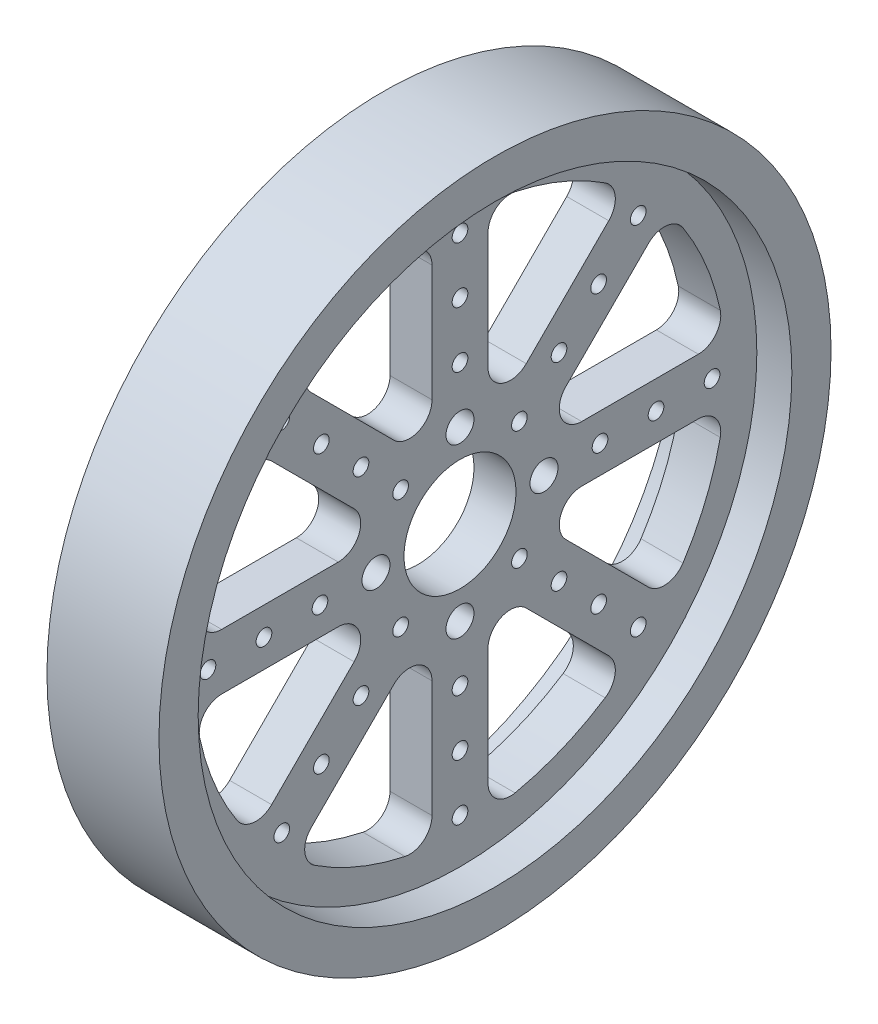
from build123d import *

# Parameters (mm, degrees)
SKETCH_1_R          = 67.31
EXTRUDE_1_DEPTH     = 4.7625
SKETCH_2_R          = 12.7
SKETCH_2_R_2        = 3.175
SKETCH_2_R_3        = 1.778
CUT_EXTRUDE_1_DEPTH = 96.666074577
FILLET_1_R          = 5.08
SKETCH_3_R          = 76.2
SKETCH_3_R_2        = 67.31
EXTRUDE_2_DEPTH     = 12.7


with BuildPart() as part:
    # ｽｹｯﾁ1 → ﾎﾞｽ - 押し出し1 (new, symmetric)
    with BuildSketch(Plane(origin=(0, 0, 0), x_dir=(0, 0, -1), z_dir=(1, 0, 0))):
        Circle(SKETCH_1_R)
    extrude(amount=EXTRUDE_1_DEPTH, both=True)

    # ｽｹｯﾁ2 → ｶｯﾄ - 押し出し1 (cut, through all)
    with BuildSketch(Plane(origin=(4.7625, 0, 0), x_dir=(0, 0, -1), z_dir=(1, 0, 0))):
        with BuildLine():
            Line((6.35, 15.330256121), (37.9291077, 46.909363821))
            ThreePointArc((37.9291077, 46.909363821), (23.085378057, 55.733032799), (6.35, 59.989858518))
            Line((6.35, 59.989858518), (6.35, 15.330256121))
        make_face()
        with BuildLine():
            ThreePointArc((59.989858518, 6.35), (55.733032799, 23.085378057), (46.909363821, 37.9291077))
            Line((46.909363821, 37.9291077), (15.330256121, 6.35))
            Line((15.330256121, 6.35), (59.989858518, 6.35))
        make_face()
        Circle(SKETCH_2_R)
        with BuildLine():
            Line((-6.35, 15.330256121), (-6.35, 59.989858518))
            ThreePointArc((-6.35, 59.989858518), (-23.085378057, 55.733032799), (-37.9291077, 46.909363821))
            Line((-37.9291077, 46.909363821), (-6.35, 15.330256121))
        make_face()
        with BuildLine():
            ThreePointArc((46.909363821, -37.9291077), (55.733032799, -23.085378057), (59.989858518, -6.35))
            Line((59.989858518, -6.35), (15.330256121, -6.35))
            Line((15.330256121, -6.35), (46.909363821, -37.9291077))
        make_face()
        with BuildLine():
            Line((-15.330256121, 6.35), (-46.909363821, 37.9291077))
            ThreePointArc((-46.909363821, 37.9291077), (-55.733032799, 23.085378057), (-59.989858518, 6.35))
            Line((-59.989858518, 6.35), (-15.330256121, 6.35))
        make_face()
        with BuildLine():
            ThreePointArc((6.35, -59.989858518), (23.085378057, -55.733032799), (37.9291077, -46.909363821))
            Line((37.9291077, -46.909363821), (6.35, -15.330256121))
            Line((6.35, -15.330256121), (6.35, -59.989858518))
        make_face()
        with BuildLine():
            Line((-15.330256121, -6.35), (-59.989858518, -6.35))
            ThreePointArc((-59.989858518, -6.35), (-55.733032799, -23.085378057), (-46.909363821, -37.9291077))
            Line((-46.909363821, -37.9291077), (-15.330256121, -6.35))
        make_face()
        with BuildLine():
            ThreePointArc((-37.9291077, -46.909363821), (-23.085378057, -55.733032799), (-6.35, -59.989858518))
            Line((-6.35, -59.989858518), (-6.35, -15.330256121))
            Line((-6.35, -15.330256121), (-37.9291077, -46.909363821))
        make_face()
        with Locations((0, 19.05)):
            Circle(SKETCH_2_R_2)
        with Locations((19.05, 0)):
            Circle(SKETCH_2_R_2)
        with Locations((0, -19.05)):
            Circle(SKETCH_2_R_2)
        with Locations((-19.05, 0)):
            Circle(SKETCH_2_R_2)
        with Locations((0, 31.75)):
            Circle(SKETCH_2_R_3)
        with Locations((0, 44.45)):
            Circle(SKETCH_2_R_3)
        with Locations((0, 57.15)):
            Circle(SKETCH_2_R_3)
        with Locations((0, -57.15)):
            Circle(SKETCH_2_R_3)
        with Locations((0, -44.45)):
            Circle(SKETCH_2_R_3)
        with Locations((0, -31.75)):
            Circle(SKETCH_2_R_3)
        with Locations((-40.411152545, -40.411152545)):
            Circle(SKETCH_2_R_3)
        with Locations((-31.430896424, -31.430896424)):
            Circle(SKETCH_2_R_3)
        with Locations((-22.450640303, -22.450640303)):
            Circle(SKETCH_2_R_3)
        with Locations((22.450640303, 22.450640303)):
            Circle(SKETCH_2_R_3)
        with Locations((31.430896424, 31.430896424)):
            Circle(SKETCH_2_R_3)
        with Locations((40.411152545, 40.411152545)):
            Circle(SKETCH_2_R_3)
        with Locations((-57.15, 0)):
            Circle(SKETCH_2_R_3)
        with Locations((-44.45, 0)):
            Circle(SKETCH_2_R_3)
        with Locations((-31.75, 0)):
            Circle(SKETCH_2_R_3)
        with Locations((31.75, 0)):
            Circle(SKETCH_2_R_3)
        with Locations((44.45, 0)):
            Circle(SKETCH_2_R_3)
        with Locations((57.15, 0)):
            Circle(SKETCH_2_R_3)
        with Locations((-40.411152545, 40.411152545)):
            Circle(SKETCH_2_R_3)
        with Locations((-31.430896424, 31.430896424)):
            Circle(SKETCH_2_R_3)
        with Locations((-22.450640303, 22.450640303)):
            Circle(SKETCH_2_R_3)
        with Locations((22.450640303, -22.450640303)):
            Circle(SKETCH_2_R_3)
        with Locations((31.430896424, -31.430896424)):
            Circle(SKETCH_2_R_3)
        with Locations((40.411152545, -40.411152545)):
            Circle(SKETCH_2_R_3)
        with Locations((13.470384182, 13.470384182)):
            Circle(SKETCH_2_R_3)
        with Locations((13.470384182, -13.470384182)):
            Circle(SKETCH_2_R_3)
        with Locations((-13.470384182, -13.470384182)):
            Circle(SKETCH_2_R_3)
        with Locations((-13.470384182, 13.470384182)):
            Circle(SKETCH_2_R_3)
    extrude(amount=-CUT_EXTRUDE_1_DEPTH, mode=Mode.SUBTRACT)

    # ﾌｨﾚｯﾄ1
    fillet_1_edges = [part.edges().sort_by_distance(p)[0] for p in [
        (0, 59.989858518, -6.35),
        (0, 15.330256121, -6.35),
        (0, 46.909363821, -37.9291077),
        (0, 6.35, 59.989858518),
        (0, -37.9291077, 46.909363821),
        (0, -46.909363821, 37.9291077),
        (0, -6.35, 59.989858518),
        (0, 37.9291077, 46.909363821),
        (0, 6.35, 15.330256121),
        (0, -6.35, 15.330256121),
        (0, -15.330256121, 6.35),
        (0, -59.989858518, 6.35),
        (0, -46.909363821, -37.9291077),
        (0, -59.989858518, -6.35),
        (0, -15.330256121, -6.35),
        (0, 6.35, -15.330256121),
        (0, -6.35, -15.330256121),
        (0, -37.9291077, -46.909363821),
        (0, 6.35, -59.989858518),
        (0, 37.9291077, -46.909363821),
        (0, -6.35, -59.989858518),
        (0, 59.989858518, 6.35),
        (0, 46.909363821, 37.9291077),
        (0, 15.330256121, 6.35),
    ]]
    fillet(fillet_1_edges, radius=FILLET_1_R)

    # ｽｹｯﾁ3 → ﾎﾞｽ - 押し出し2 (add, symmetric)
    with BuildSketch(Plane(origin=(0, 0, 0), x_dir=(0, 0, -1), z_dir=(1, 0, 0))):
        Circle(SKETCH_3_R)
        Circle(SKETCH_3_R_2, mode=Mode.SUBTRACT)
    extrude(amount=EXTRUDE_2_DEPTH, both=True)


solid = part.part
